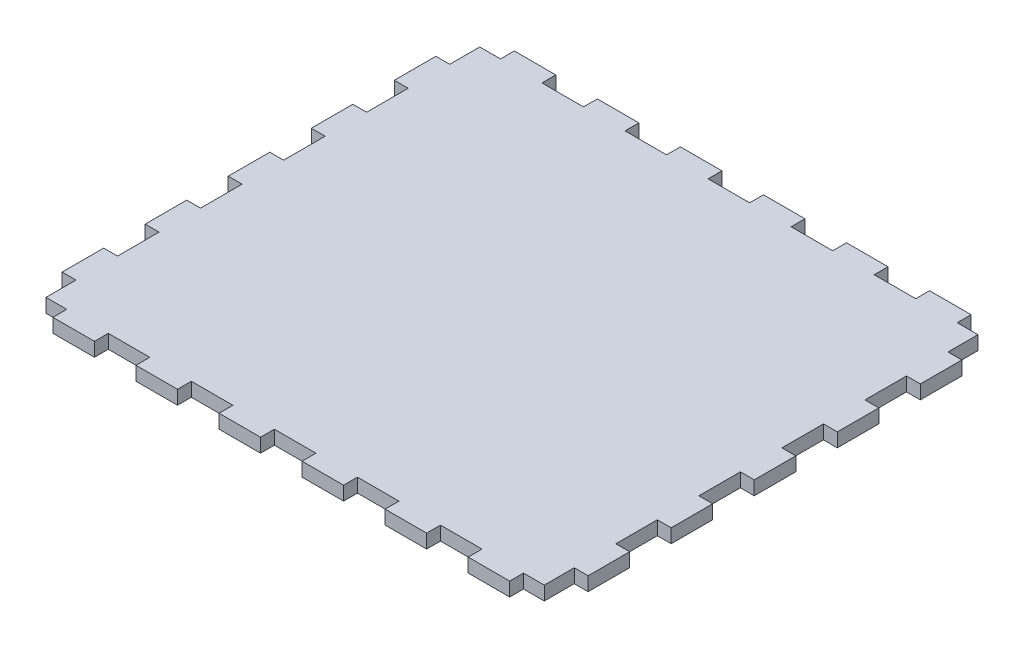
from build123d import *

# Parameters (mm, degrees)
BOSS_EXTRUDE1_DEPTH = 1.5


with BuildPart() as part:
    # Sketch1 → Boss-Extrude1 (new, symmetric)
    with BuildSketch(Plane(origin=(0, 0, 0), x_dir=(1, 0, 0), z_dir=(0, 1, 0))):
        Polygon((49.5, 50), (40.5, 50), (40.5, 47), (31.5, 47), (31.5, 50), (22.5, 50), (22.5, 47), (13.5, 47), (13.5, 50), (4.5, 50), (4.5, 47), (-4.5, 47), (-4.5, 50), (-13.5, 50), (-13.5, 47), (-22.5, 47), (-22.5, 50), (-31.5, 50), (-31.5, 47), (-40.5, 47), (-40.5, 50), (-49.5, 50), (-49.5, 47), (-54, 47), (-54, 40.5), (-57, 40.5), (-57, 31.5), (-54, 31.5), (-54, 22.5), (-57, 22.5), (-57, 13.5), (-54, 13.5), (-54, 4.5), (-57, 4.5), (-57, -4.5), (-54, -4.5), (-54, -13.5), (-57, -13.5), (-57, -22.5), (-54, -22.5), (-54, -31.5), (-57, -31.5), (-57, -40.5), (-54, -40.5), (-54, -47), (-49.5, -47), (-49.5, -50), (-40.5, -50), (-40.5, -47), (-31.5, -47), (-31.5, -50), (-22.5, -50), (-22.5, -47), (-13.5, -47), (-13.5, -50), (-4.5, -50), (-4.5, -47), (4.5, -47), (4.5, -50), (13.5, -50), (13.5, -47), (22.5, -47), (22.5, -50), (31.5, -50), (31.5, -47), (40.5, -47), (40.5, -50), (49.5, -50), (49.5, -47), (54, -47), (54, -40.5), (57, -40.5), (57, -31.5), (54, -31.5), (54, -22.5), (57, -22.5), (57, -13.5), (54, -13.5), (54, -4.5), (57, -4.5), (57, 4.5), (54, 4.5), (54, 13.5), (57, 13.5), (57, 22.5), (54, 22.5), (54, 31.5), (57, 31.5), (57, 40.5), (54, 40.5), (54, 47), (49.5, 47), align=None)
    extrude(amount=BOSS_EXTRUDE1_DEPTH, both=True)


solid = part.part
